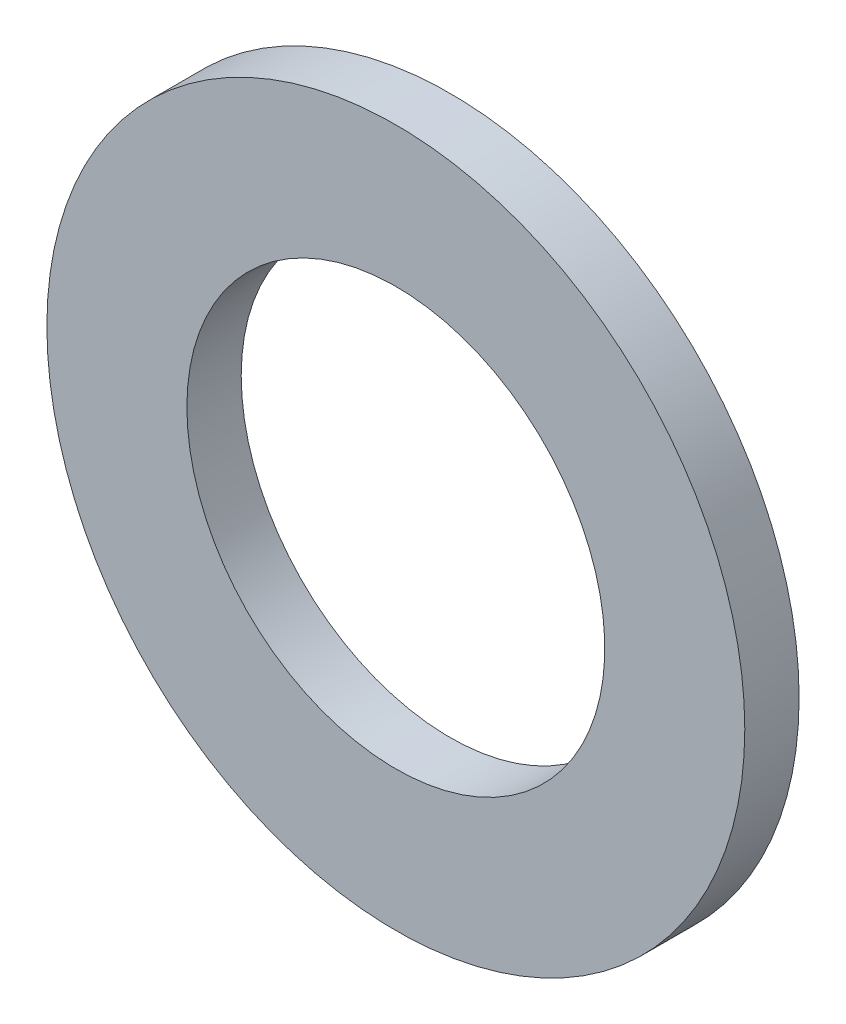
from build123d import *

# Parameters (mm, degrees)
SKETCH1_R           = 21.209
SKETCH1_R_2         = 12.7
BOSS_EXTRUDE1_DEPTH = 3.302


with BuildPart() as part:
    # Sketch1 → Boss-Extrude1 (new body)
    with BuildSketch(Plane.XY):
        with Locations(Location((0, 0, 0), (0, 0, 180))):
            Circle(SKETCH1_R)
        with Locations(Location((0, 0, 0), (0, 0, 180))):
            Circle(SKETCH1_R_2, mode=Mode.SUBTRACT)
    extrude(amount=BOSS_EXTRUDE1_DEPTH)


solid = part.part
